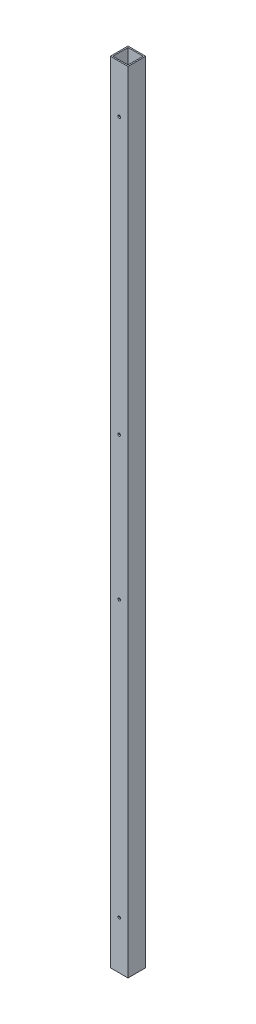
from build123d import *

# Parameters (mm, degrees)
SKETCH1_W                        = 44.45
SKETCH1_H                        = 44.45
SKETCH1_W_2                      = 38.1
SKETCH1_H_2                      = 38.1
BOSS_EXTRUDE1_DEPTH              = 1984.375
F_17_64_0_26563_DIAMETER_HOLE1_D = 6.747002


with BuildPart() as part:
    # Sketch1 → Boss-Extrude1 (new body)
    with BuildSketch(Plane(origin=(0, 0, 0), x_dir=(1, 0, 0), z_dir=(0, 1, 0))):
        Rectangle(SKETCH1_W, SKETCH1_H)
        Rectangle(SKETCH1_W_2, SKETCH1_H_2, mode=Mode.SUBTRACT)
    extrude(amount=BOSS_EXTRUDE1_DEPTH)

    # 17/64 (0.26563) Diameter Hole1 (through all)
    with Locations(Plane.XY.offset(22.225)):
        with Locations((0, 812.8), (0, 120.65), (0, 1171.575), (0, 1863.725)):
            Hole(F_17_64_0_26563_DIAMETER_HOLE1_D / 2)


solid = part.part
